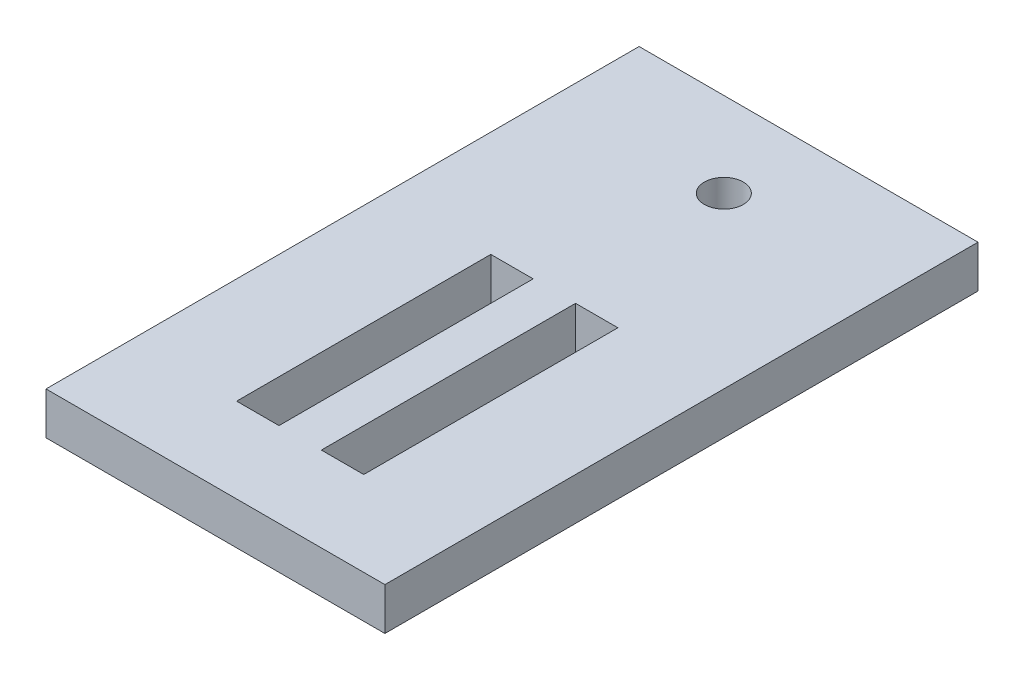
from build123d import *

# Parameters (mm, degrees)
SKETCH1_W           = 25.4
SKETCH1_H           = 44.45
SKETCH1_R           = 1.4605
SKETCH1_W_2         = 3.175
SKETCH1_H_2         = 19.05
BOSS_EXTRUDE1_DEPTH = 3.175


with BuildPart() as part:
    # Sketch1 → Boss-Extrude1 (new body)
    with BuildSketch(Plane(origin=(0, 0, 0), x_dir=(1, 0, 0), z_dir=(0, 1, 0))):
        with Locations((12.7, 22.225)):
            Rectangle(SKETCH1_W, SKETCH1_H)
        with Locations(Location((12.7, 38.1, 0), (0, 0, 270))):
            Circle(SKETCH1_R, mode=Mode.SUBTRACT)
        with Locations((9.525, 15.875)):
            Rectangle(SKETCH1_W_2, SKETCH1_H_2, mode=Mode.SUBTRACT)
        with Locations((15.875, 15.875)):
            Rectangle(SKETCH1_W_2, SKETCH1_H_2, mode=Mode.SUBTRACT)
    extrude(amount=BOSS_EXTRUDE1_DEPTH)


solid = part.part
